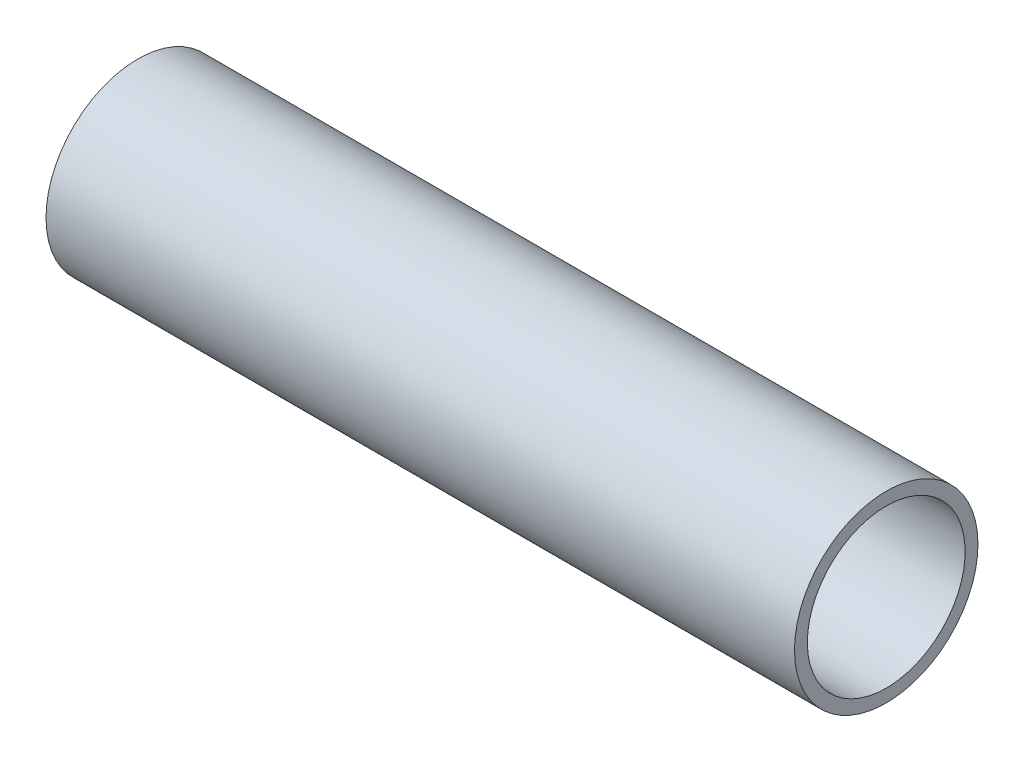
from build123d import *

# Parameters (mm, degrees)
TUBE_T8_STUB_SKETCH_W = 51.8
TUBE_T8_STUB_SKETCH_H = 0.889


with BuildPart() as part:
    # Tube_T8_Stub Sketch → Tube_T8_Stub (revolve)
    with BuildSketch(Plane.XY):
        with Locations((0, 5.9055)):
            Rectangle(TUBE_T8_STUB_SKETCH_W, TUBE_T8_STUB_SKETCH_H)
    revolve(axis=Axis((-1000, 0, 0), (1, 0, 0)))


solid = part.part
